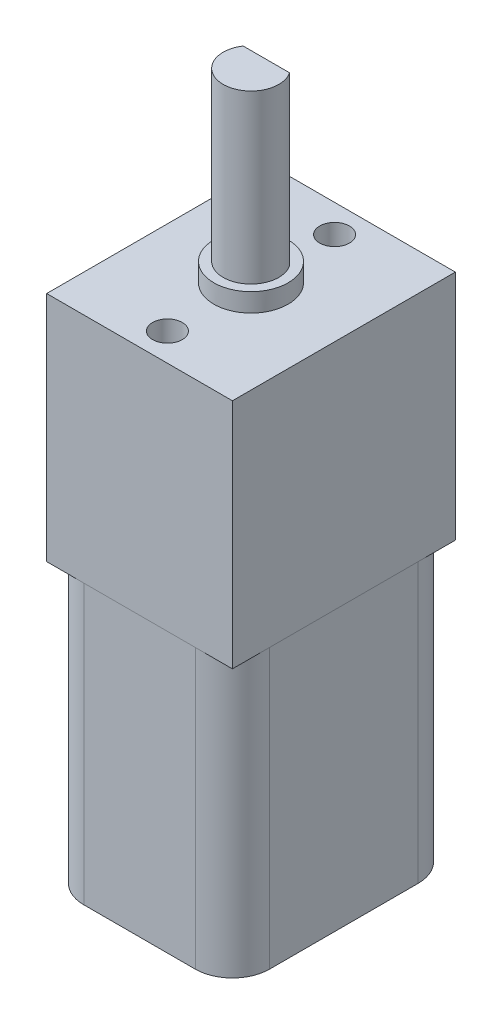
from build123d import *

# Parameters (mm, degrees)
SKETCH_1_W                  = 10
SKETCH_1_H                  = 12
EXTRUDE_1_DEPTH             = 27.5
EXTRUDE_2_DEPTH             = 10
SKETCH_3_R                  = 2
EXTRUDE_3_DEPTH             = 1
HOLE_WIZARD_1_6_1_6_1_D     = 1.6
HOLE_WIZARD_1_6_1_6_1_DEPTH = 2
SKETCH_7_R                  = 2.5
EXTRUDE_4_DEPTH             = 2
FILLET_1_R                  = 2


with BuildPart() as part:
    # 草图1 → 凸台-拉伸1 (new body)
    with BuildSketch(Plane(origin=(0, 0, 0), x_dir=(1, 0, 0), z_dir=(0, 1, 0))):
        with Locations((5, 6)):
            Rectangle(SKETCH_1_W, SKETCH_1_H)
    extrude(amount=EXTRUDE_1_DEPTH)

    # 草图2 → 凸台-拉伸2 (add)
    with BuildSketch(Plane(origin=(0, 27.5, 0), x_dir=(1, 0, 0), z_dir=(0, 1, 0))):
        with BuildLine():
            Line((3.75, 6.829156198), (6.25, 6.829156198))
            ThreePointArc((6.25, 6.829156198), (5, 4.5), (3.75, 6.829156198))
        make_face()
    extrude(amount=EXTRUDE_2_DEPTH)

    # 草图3 → 凸台-拉伸3 (add)
    with BuildSketch(Plane(origin=(0, 27.5, 0), x_dir=(1, 0, 0), z_dir=(0, 1, 0))):
        with Locations(Location((5, 6, 0), (0, 0, 90))):
            Circle(SKETCH_3_R)
    extrude(amount=EXTRUDE_3_DEPTH)

    # Ø1.6 (1.6) 直径孔1
    with Locations(Plane(origin=(0, 27.5, 0), x_dir=(1, 0, 0), z_dir=(0, 1, 0))):
        with Locations((5, 1.5), (5, 10.5)):
            Hole(HOLE_WIZARD_1_6_1_6_1_D / 2, depth=HOLE_WIZARD_1_6_1_6_1_DEPTH)

    # 草图7 → 凸台-拉伸4 (add)
    with BuildSketch(Plane.XZ):
        with Locations(Location((5, -6, 0), (0, 0, 270))):
            Circle(SKETCH_7_R)
    extrude(amount=EXTRUDE_4_DEPTH)


with BuildPart() as body_2:
    # Split Bodies 1: the piece on the far side of the plane
    add(part.part)
    split(bisect_by=Plane(origin=(0, 15, 0), x_dir=(0, 0, -1), z_dir=(0, -1, 0)), keep=Keep.BOTTOM)


with BuildPart() as part_1:
    add(part.part)

    # Split Bodies 1
    split(bisect_by=Plane(origin=(0, 15, 0), x_dir=(0, 0, -1), z_dir=(0, -1, 0)), keep=Keep.TOP)

    # 圆角1
    fillet_1_edges = [part_1.edges().sort_by_distance(p)[0] for p in [
        (0, 7.5, -12),
        (10, 7.5, -12),
        (10, 7.5, 0),
        (0, 7.5, 0),
    ]]
    fillet(fillet_1_edges, radius=FILLET_1_R)


solid = Compound([body_2.part, part_1.part])
